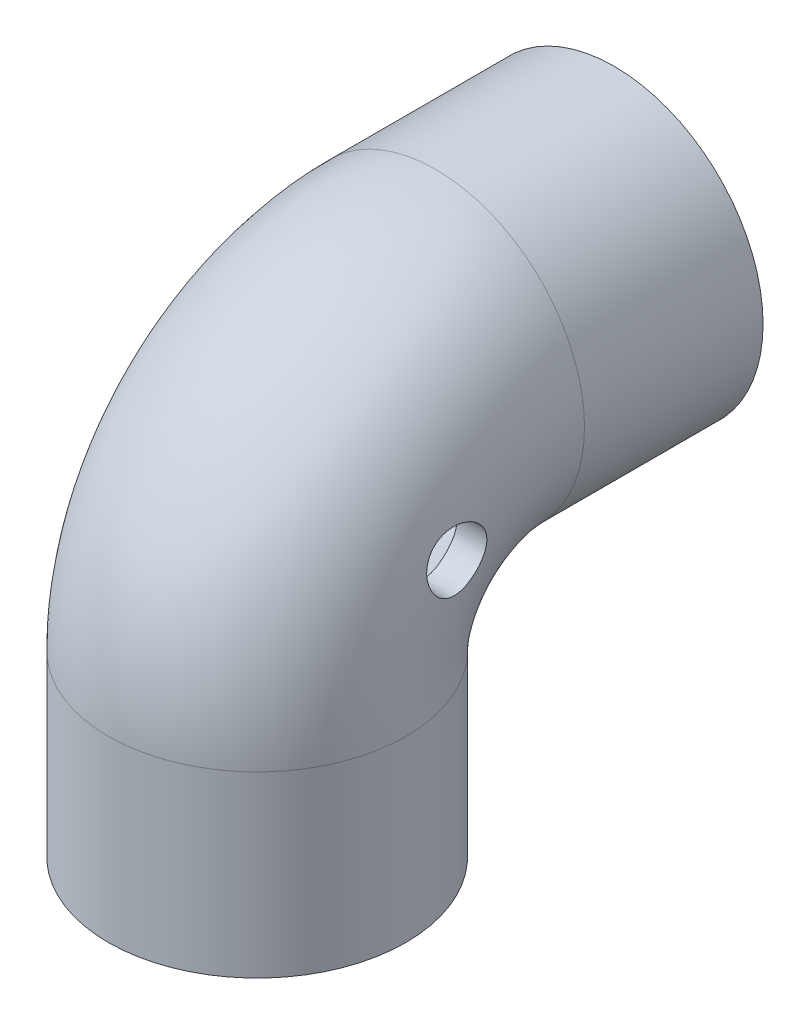
from build123d import *

# Parameters (mm, degrees)
ESBO_O4_R                  = 12.5
ESBO_O4_R_2                = 10
CORTE_EXTRUS_O1_DEPTH      = 22
CORTE_EXTRUS_O1_DEPTH_BACK = 23
ESBO_O5_R                  = 2.5


with BuildPart() as part:
    # Varredura1: sweep along a path in Esboço3
    with BuildLine(Plane(origin=(0, 0, 0), x_dir=(0, 0, -1), z_dir=(1, 0, 0))) as varredura1_path:
        Line((0, 0), (0, 15))
        ThreePointArc((0, 15), (4.393398282, 25.606601718), (15, 30))
        Line((15, 30), (30, 30))
    # Esboço4 → Varredura1 (sweep)
    with BuildSketch(Plane(origin=(0, 0, 0), x_dir=(1, 0, 0), z_dir=(0, 1, 0))):
        Circle(ESBO_O4_R)
        Circle(ESBO_O4_R_2, mode=Mode.SUBTRACT)
    sweep(path=varredura1_path.line)

    # Esboço5 → Corte-extrusão1 (cut, two sides: drawn at the far end of the back side and taken through both)
    with BuildSketch(Plane(origin=(0, 0, 0), x_dir=(0, 0, -1), z_dir=(1, 0, 0)).offset(-CORTE_EXTRUS_O1_DEPTH_BACK)):
        with Locations(Location((4.393398282, 25.606601718, 0), (0, 0, 325.914839644))):
            Circle(ESBO_O5_R)
    extrude(amount=CORTE_EXTRUS_O1_DEPTH + CORTE_EXTRUS_O1_DEPTH_BACK, mode=Mode.SUBTRACT)


solid = part.part
